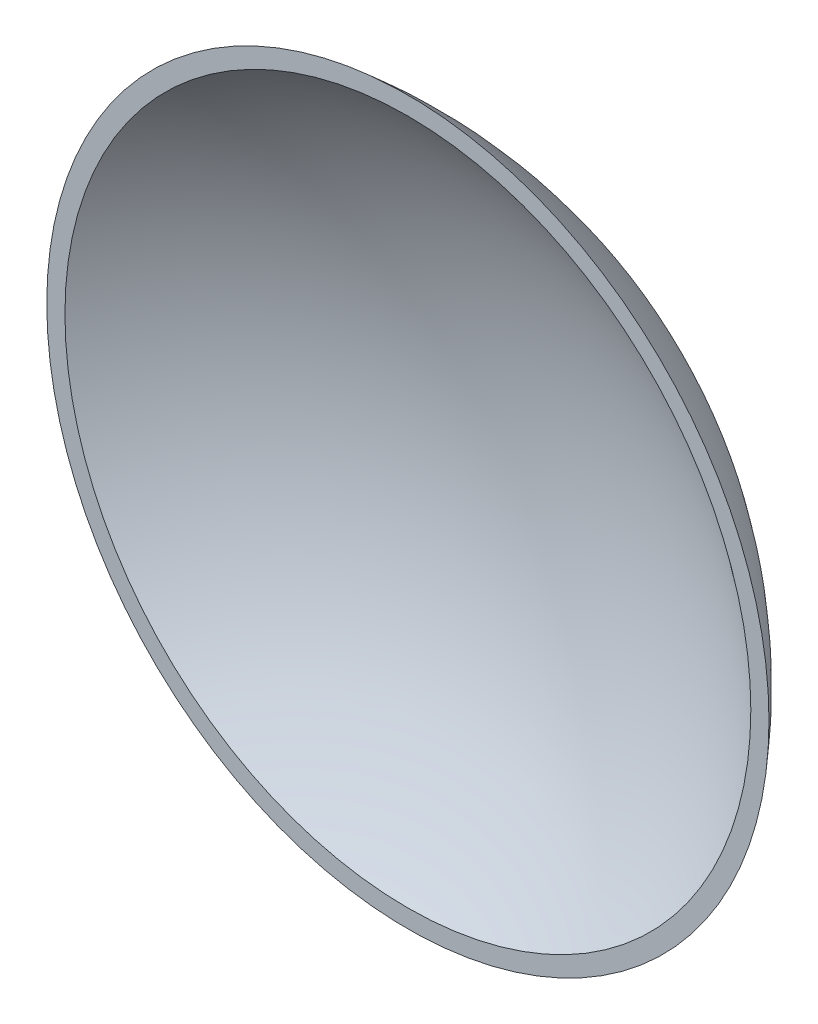
from build123d import *


with BuildPart() as part:
    # Sketch2 → Revolve1 (revolve)
    with BuildSketch(Plane(origin=(0, 0, 0), x_dir=(1, 0, 0), z_dir=(0, 1, 0))):
        with BuildLine():
            Line((0, 26.300890152), (0, 19.839902828))
            ThreePointArc((0, 19.839902828), (-25.612591734, 15.406435033), (-48.24480025, 2.621927622))
            Line((-48.24480025, 2.621927622), (-50.8, 2.621927622))
            ThreePointArc((-50.8, 2.621927622), (-28.023799111, 20.090413734), (0, 26.300890152))
        make_face()
    revolve(axis=Axis((0, 0, 0), (0, 0, -1)))


solid = part.part
